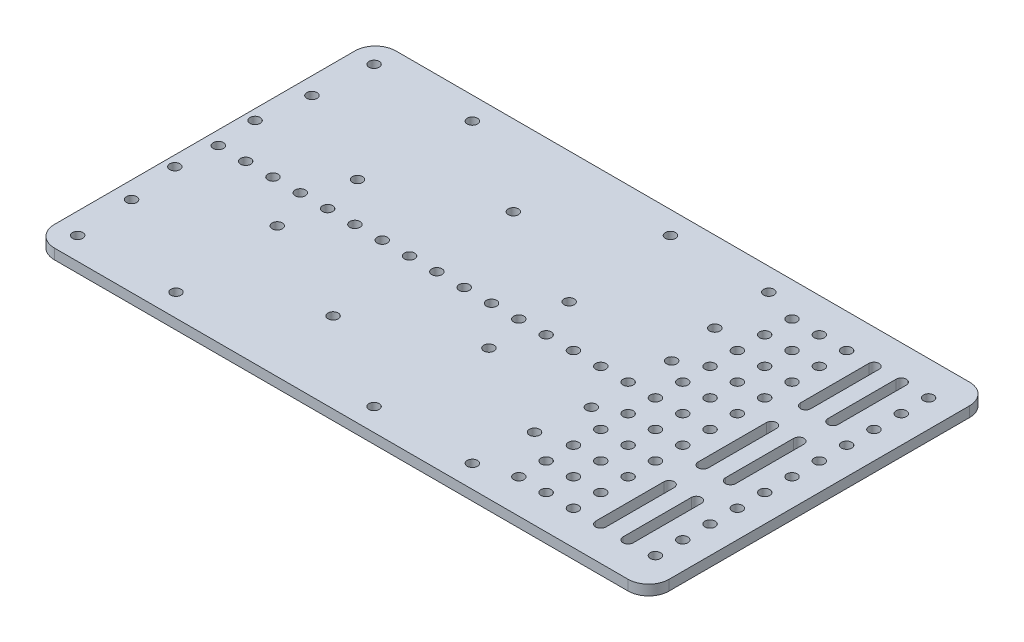
from build123d import *

# Parameters (mm, degrees)
SKETCH2_W           = 180
SKETCH2_H           = 100
BOSS_EXTRUDE1_DEPTH = 3
SKETCH3_R           = 1.5
CUT_EXTRUDE1_DEPTH  = 104
CUT_EXTRUDE2_DEPTH  = 104
SKETCH7_R           = 1.5
CUT_EXTRUDE3_DEPTH  = 104
FILLET1_R           = 6


with BuildPart() as part:
    # Sketch2 → Boss-Extrude1 (new body)
    with BuildSketch(Plane(origin=(0, 0, 0), x_dir=(1, 0, 0), z_dir=(0, 1, 0))):
        Rectangle(SKETCH2_W, SKETCH2_H)
    extrude(amount=BOSS_EXTRUDE1_DEPTH)

    # Sketch3 → Cut-Extrude1 (cut, through all)
    with BuildSketch(Plane(origin=(0, 3, 0), x_dir=(1, 0, 0), z_dir=(0, 1, 0))):
        with Locations(Location((-57, 11.75, 0), (0, 0, 270))):
            Circle(SKETCH3_R)
        with Locations(Location((-87, 11.75, 0), (0, 0, 270))):
            Circle(SKETCH3_R)
        with Locations(Location((-87, -11.75, 0), (0, 0, 270))):
            Circle(SKETCH3_R)
        with Locations(Location((-57, -11.75, 0), (0, 0, 270))):
            Circle(SKETCH3_R)
        with Locations(Location((-55, 43.4, 0), (0, 0, 270))):
            Circle(SKETCH3_R)
        with Locations(Location((31.8, 43.4, 0), (0, 0, 270))):
            Circle(SKETCH3_R)
        with Locations(Location((31.8, -43.4, 0), (0, 0, 270))):
            Circle(SKETCH3_R)
        with Locations(Location((-55, -43.4, 0), (0, 0, 270))):
            Circle(SKETCH3_R)
        with Locations(Location((-26, -26.4, 0), (0, 0, 270))):
            Circle(SKETCH3_R)
        with Locations(Location((33, -26.4, 0), (0, 0, 270))):
            Circle(SKETCH3_R)
        with Locations(Location((33, 26.4, 0), (0, 0, 270))):
            Circle(SKETCH3_R)
        with Locations(Location((-26, 26.4, 0), (0, 0, 270))):
            Circle(SKETCH3_R)
    cut_extrude1 = extrude(amount=-CUT_EXTRUDE1_DEPTH, mode=Mode.SUBTRACT)

    # Sketch6 → Cut-Extrude2 (cut, through all)
    with BuildSketch(Plane(origin=(0, 3, 0), x_dir=(1, 0, 0), z_dir=(0, 1, 0))):
        with BuildLine():
            Line((75.5, 10), (75.5, -10))
            ThreePointArc((75.5, -10), (74, -11.5), (72.5, -10))
            Line((72.5, -10), (72.5, 10))
            ThreePointArc((72.5, 10), (74, 11.5), (75.5, 10))
        make_face()
        with BuildLine():
            Line((72.5, -40), (72.5, -20))
            ThreePointArc((72.5, -20), (74, -18.5), (75.5, -20))
            Line((75.5, -20), (75.5, -40))
            ThreePointArc((75.5, -40), (74, -41.5), (72.5, -40))
        make_face()
        with BuildLine():
            Line((72.5, 20), (72.5, 40))
            ThreePointArc((72.5, 40), (74, 41.5), (75.5, 40))
            Line((75.5, 40), (75.5, 20))
            ThreePointArc((75.5, 20), (74, 18.5), (72.5, 20))
        make_face()
        with BuildLine():
            Line((67.5, 10), (67.5, -10))
            ThreePointArc((67.5, -10), (66, -11.5), (64.5, -10))
            Line((64.5, -10), (64.5, 10))
            ThreePointArc((64.5, 10), (66, 11.5), (67.5, 10))
        make_face()
        with BuildLine():
            Line((64.5, -40), (64.5, -20))
            ThreePointArc((64.5, -20), (66, -18.5), (67.5, -20))
            Line((67.5, -20), (67.5, -40))
            ThreePointArc((67.5, -40), (66, -41.5), (64.5, -40))
        make_face()
        with BuildLine():
            Line((64.5, 20), (64.5, 40))
            ThreePointArc((64.5, 40), (66, 41.5), (67.5, 40))
            Line((67.5, 40), (67.5, 20))
            ThreePointArc((67.5, 20), (66, 18.5), (64.5, 20))
        make_face()
    extrude(amount=-CUT_EXTRUDE2_DEPTH, mode=Mode.SUBTRACT)

    # Sketch7 → Cut-Extrude3 (cut, through all)
    with BuildSketch(Plane(origin=(0, 3, 0), x_dir=(1, 0, 0), z_dir=(0, 1, 0))):
        with Locations(Location((82, 0, 0), (0, 0, 270))):
            Circle(SKETCH7_R)
        with Locations(Location((58, 0, 0), (0, 0, 270))):
            Circle(SKETCH7_R)
        with Locations(Location((50, 0, 0), (0, 0, 270))):
            Circle(SKETCH7_R)
        with Locations(Location((42, 0, 0), (0, 0, 270))):
            Circle(SKETCH7_R)
        with Locations(Location((34, 0, 0), (0, 0, 270))):
            Circle(SKETCH7_R)
        with Locations(Location((26, 0, 0), (0, 0, 270))):
            Circle(SKETCH7_R)
        with Locations(Location((18, 0, 0), (0, 0, 270))):
            Circle(SKETCH7_R)
        with Locations(Location((10, 0, 0), (0, 0, 270))):
            Circle(SKETCH7_R)
        with Locations(Location((2, 0, 0), (0, 0, 270))):
            Circle(SKETCH7_R)
        with Locations(Location((-6, 0, 0), (0, 0, 270))):
            Circle(SKETCH7_R)
        with Locations(Location((-14, 0, 0), (0, 0, 270))):
            Circle(SKETCH7_R)
        with Locations(Location((-22, 0, 0), (0, 0, 270))):
            Circle(SKETCH7_R)
        with Locations(Location((-30, 0, 0), (0, 0, 270))):
            Circle(SKETCH7_R)
        with Locations(Location((-38, 0, 0), (0, 0, 270))):
            Circle(SKETCH7_R)
        with Locations(Location((-46, 0, 0), (0, 0, 270))):
            Circle(SKETCH7_R)
        with Locations(Location((-54, 0, 0), (0, 0, 270))):
            Circle(SKETCH7_R)
        with Locations(Location((-62, 0, 0), (0, 0, 270))):
            Circle(SKETCH7_R)
        with Locations(Location((-70, 0, 0), (0, 0, 270))):
            Circle(SKETCH7_R)
        with Locations(Location((-78, 0, 0), (0, 0, 270))):
            Circle(SKETCH7_R)
        with Locations(Location((-86, 0, 0), (0, 0, 270))):
            Circle(SKETCH7_R)
        with Locations(Location((42, 8, 0), (0, 0, 270))):
            Circle(SKETCH7_R)
        with Locations(Location((50, 8, 0), (0, 0, 270))):
            Circle(SKETCH7_R)
        with Locations(Location((58, 8, 0), (0, 0, 270))):
            Circle(SKETCH7_R)
        with Locations(Location((82, 8, 0), (0, 0, 270))):
            Circle(SKETCH7_R)
        with Locations(Location((42, 16, 0), (0, 0, 270))):
            Circle(SKETCH7_R)
        with Locations(Location((50, 16, 0), (0, 0, 270))):
            Circle(SKETCH7_R)
        with Locations(Location((58, 16, 0), (0, 0, 270))):
            Circle(SKETCH7_R)
        with Locations(Location((82, 16, 0), (0, 0, 270))):
            Circle(SKETCH7_R)
        with Locations(Location((42, 24, 0), (0, 0, 270))):
            Circle(SKETCH7_R)
        with Locations(Location((50, 24, 0), (0, 0, 270))):
            Circle(SKETCH7_R)
        with Locations(Location((58, 24, 0), (0, 0, 270))):
            Circle(SKETCH7_R)
        with Locations(Location((82, 24, 0), (0, 0, 270))):
            Circle(SKETCH7_R)
        with Locations(Location((42, 32, 0), (0, 0, 270))):
            Circle(SKETCH7_R)
        with Locations(Location((50, 32, 0), (0, 0, 270))):
            Circle(SKETCH7_R)
        with Locations(Location((58, 32, 0), (0, 0, 270))):
            Circle(SKETCH7_R)
        with Locations(Location((82, 32, 0), (0, 0, 270))):
            Circle(SKETCH7_R)
        with Locations(Location((42, 40, 0), (0, 0, 270))):
            Circle(SKETCH7_R)
        with Locations(Location((50, 40, 0), (0, 0, 270))):
            Circle(SKETCH7_R)
        with Locations(Location((58, 40, 0), (0, 0, 270))):
            Circle(SKETCH7_R)
        with Locations(Location((82, 40, 0), (0, 0, 270))):
            Circle(SKETCH7_R)
        with Locations(Location((42, -8, 0), (0, 0, 270))):
            Circle(SKETCH7_R)
        with Locations(Location((50, -8, 0), (0, 0, 270))):
            Circle(SKETCH7_R)
        with Locations(Location((58, -8, 0), (0, 0, 270))):
            Circle(SKETCH7_R)
        with Locations(Location((82, -8, 0), (0, 0, 270))):
            Circle(SKETCH7_R)
        with Locations(Location((42, -16, 0), (0, 0, 270))):
            Circle(SKETCH7_R)
        with Locations(Location((50, -16, 0), (0, 0, 270))):
            Circle(SKETCH7_R)
        with Locations(Location((58, -16, 0), (0, 0, 270))):
            Circle(SKETCH7_R)
        with Locations(Location((82, -16, 0), (0, 0, 270))):
            Circle(SKETCH7_R)
        with Locations(Location((42, -24, 0), (0, 0, 270))):
            Circle(SKETCH7_R)
        with Locations(Location((50, -24, 0), (0, 0, 270))):
            Circle(SKETCH7_R)
        with Locations(Location((58, -24, 0), (0, 0, 270))):
            Circle(SKETCH7_R)
        with Locations(Location((82, -24, 0), (0, 0, 270))):
            Circle(SKETCH7_R)
        with Locations(Location((42, -32, 0), (0, 0, 270))):
            Circle(SKETCH7_R)
        with Locations(Location((50, -32, 0), (0, 0, 270))):
            Circle(SKETCH7_R)
        with Locations(Location((58, -32, 0), (0, 0, 270))):
            Circle(SKETCH7_R)
        with Locations(Location((82, -32, 0), (0, 0, 270))):
            Circle(SKETCH7_R)
        with Locations(Location((42, -40, 0), (0, 0, 270))):
            Circle(SKETCH7_R)
        with Locations(Location((50, -40, 0), (0, 0, 270))):
            Circle(SKETCH7_R)
        with Locations(Location((58, -40, 0), (0, 0, 270))):
            Circle(SKETCH7_R)
        with Locations(Location((82, -40, 0), (0, 0, 270))):
            Circle(SKETCH7_R)
    extrude(amount=-CUT_EXTRUDE3_DEPTH, mode=Mode.SUBTRACT)

    # Mirror2: Cut-Extrude1 across plane
    add(cut_extrude1.mirror(Plane.ZY.offset(26)), mode=Mode.SUBTRACT)

    # Fillet1
    fillet1_edges = [part.edges().sort_by_distance(p)[0] for p in [
        (-90, 1.5, -50),
        (90, 1.5, -50),
        (90, 1.5, 50),
        (-90, 1.5, 50),
    ]]
    fillet(fillet1_edges, radius=FILLET1_R)


solid = part.part
